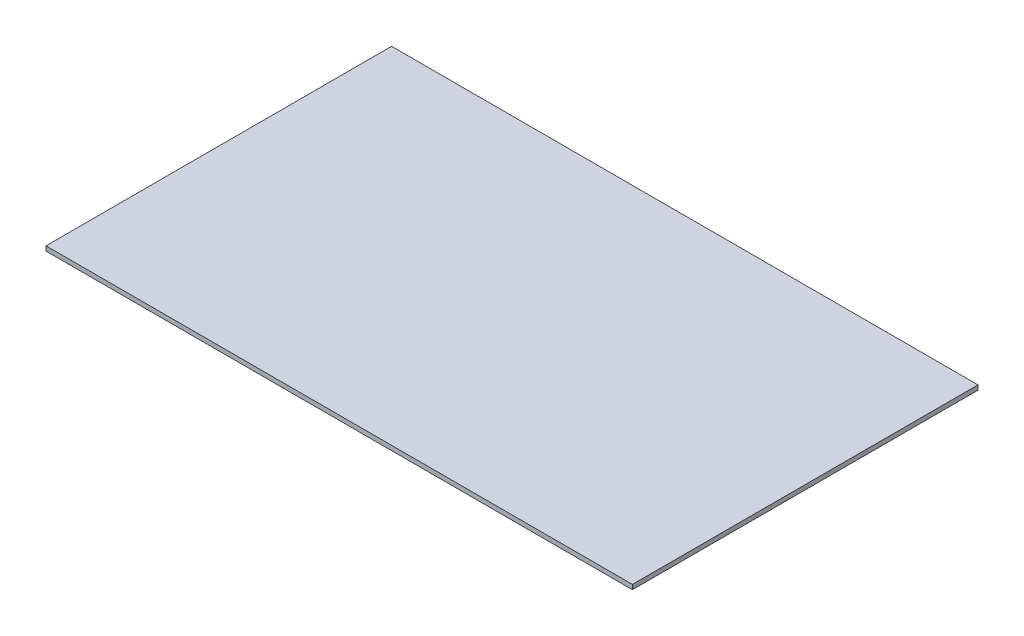
from build123d import *

# Parameters (mm, degrees)
SKETCH1_W           = 711.2
SKETCH1_H           = 419.1
BOSS_EXTRUDE1_DEPTH = 5.55625


with BuildPart() as part:
    # Sketch1 → Boss-Extrude1 (new body)
    with BuildSketch(Plane(origin=(0, 0, 0), x_dir=(1, 0, 0), z_dir=(0, 1, 0))):
        Rectangle(SKETCH1_W, SKETCH1_H)
    extrude(amount=BOSS_EXTRUDE1_DEPTH)


solid = part.part
